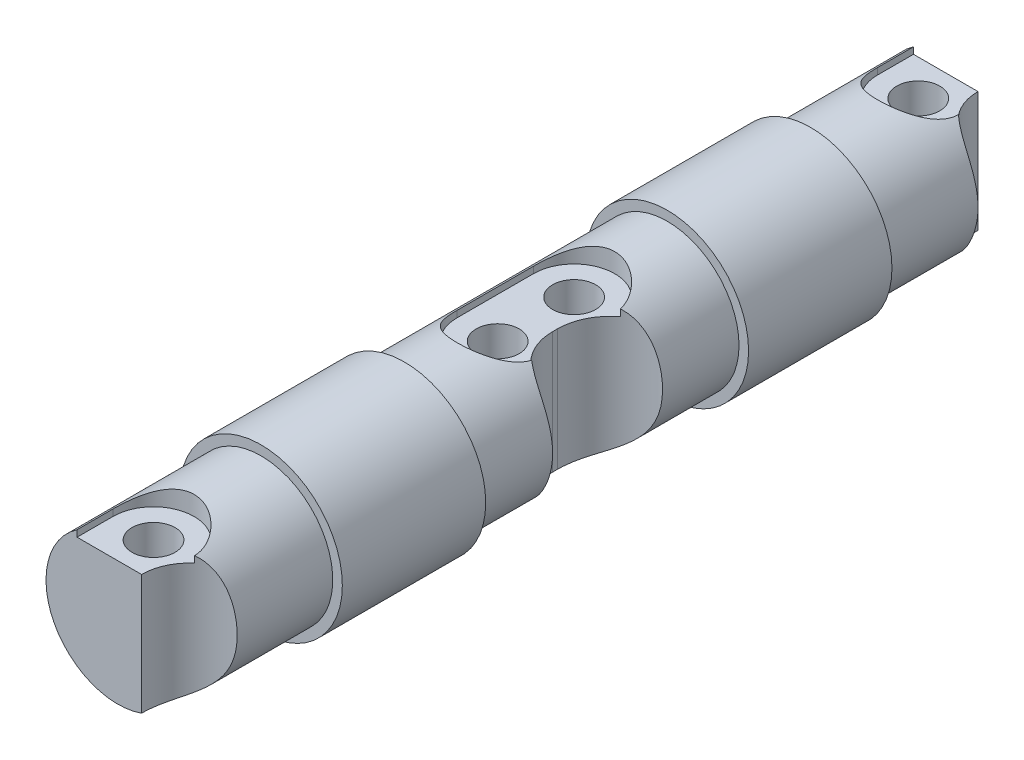
from build123d import *

# Parameters (mm, degrees)
CROQUIS1_R                 = 15
SALIENTE_EXTRUIR1_DEPTH    = 175
CROQUIS2_R                 = 4.5
CORTAR_EXTRUIR1_DEPTH      = 177.281025638
CORTAR_EXTRUIR2_START      = 15
CORTAR_EXTRUIR2_DEPTH      = 4
CROQUIS4_R                 = 10
CORTAR_EXTRUIR3_DEPTH      = 177.281025756
CORTAR_EXTRUIR4_DEPTH      = 177.281025756
CORTAR_EXTRUIR4_DEPTH_BACK = 177.281025756
CROQUIS9_R                 = 4.5
CORTAR_EXTRUIR5_START      = 15
CORTAR_EXTRUIR5_DEPTH      = 4
CORTAR_EXTRUIR6_DEPTH      = 177.281025756
CORTAR_EXTRUIR6_DEPTH_BACK = 177.281025756
SALIENTE_EXTRUIR2_START    = 30
CROQUIS16_R                = 17
CROQUIS16_R_2              = 15
SALIENTE_EXTRUIR2_DEPTH    = 30


with BuildPart() as part:
    # Croquis1 → Saliente-Extruir1 (new body)
    with BuildSketch(Plane.XY):
        Circle(CROQUIS1_R)
    extrude(amount=SALIENTE_EXTRUIR1_DEPTH)

    # Croquis2 → Cortar-Extruir1 (cut, symmetric)
    with BuildSketch(Plane(origin=(0, 0, 0), x_dir=(1, 0, 0), z_dir=(0, 1, 0))):
        with Locations((0, -7.5)):
            Circle(CROQUIS2_R)
    cortar_extruir1 = extrude(amount=CORTAR_EXTRUIR1_DEPTH, both=True, mode=Mode.SUBTRACT)

    # Croquis3 → Cortar-Extruir2 (cut)
    with BuildSketch(Plane(origin=(0, 0, 0), x_dir=(1, 0, 0), z_dir=(0, 1, 0)).offset(CORTAR_EXTRUIR2_START)):
        with BuildLine():
            Line((-8.5, -7.5), (-8.5, 0))
            Line((-8.5, 0), (8.5, 0))
            Line((8.5, 0), (8.5, -7.5))
            ThreePointArc((8.5, -7.5), (0, -16), (-8.5, -7.5))
        make_face()
    cortar_extruir2 = extrude(amount=-CORTAR_EXTRUIR2_DEPTH, mode=Mode.SUBTRACT)

    # Croquis4 → Cortar-Extruir3 (cut, symmetric)
    with BuildSketch(Plane(origin=(0, 0, 0), x_dir=(1, 0, 0), z_dir=(0, 1, 0))):
        with Locations((15, 0)):
            Circle(CROQUIS4_R)
    cortar_extruir3 = extrude(amount=CORTAR_EXTRUIR3_DEPTH, both=True, mode=Mode.SUBTRACT)

    # Simetría1: Cortar-Extruir1, Cortar-Extruir2, Cortar-Extruir3 across plane
    add(cortar_extruir1.mirror(Plane.XY.offset(87.5)), mode=Mode.SUBTRACT)
    add(cortar_extruir2.mirror(Plane.XY.offset(87.5)), mode=Mode.SUBTRACT)
    add(cortar_extruir3.mirror(Plane.XY.offset(87.5)), mode=Mode.SUBTRACT)

    # Croquis9 → Cortar-Extruir4 (cut, two sides: drawn at the far end of the back side and taken through both)
    with BuildSketch(Plane(origin=(0, 0, 0), x_dir=(1, 0, 0), z_dir=(0, 1, 0)).offset(-CORTAR_EXTRUIR4_DEPTH_BACK)):
        with Locations((0, -79.5)):
            Circle(CROQUIS9_R)
        with Locations((0, -95.5)):
            Circle(CROQUIS9_R)
    extrude(amount=CORTAR_EXTRUIR4_DEPTH + CORTAR_EXTRUIR4_DEPTH_BACK, mode=Mode.SUBTRACT)

    # Croquis10 → Cortar-Extruir5 (cut)
    with BuildSketch(Plane(origin=(0, 0, 0), x_dir=(1, 0, 0), z_dir=(0, 1, 0)).offset(CORTAR_EXTRUIR5_START)):
        with BuildLine():
            Line((8.5, -79.5), (8.5, -95.5))
            ThreePointArc((8.5, -95.5), (0, -104), (-8.5, -95.5))
            Line((-8.5, -95.5), (-8.5, -79.5))
            ThreePointArc((-8.5, -79.5), (0, -71), (8.5, -79.5))
        make_face()
    extrude(amount=-CORTAR_EXTRUIR5_DEPTH, mode=Mode.SUBTRACT)

    # Croquis15 → Cortar-Extruir6 (cut, two sides: drawn at the far end of the back side and taken through both)
    with BuildSketch(Plane(origin=(0, 0, 0), x_dir=(1, 0, 0), z_dir=(0, 1, 0)).offset(-CORTAR_EXTRUIR6_DEPTH_BACK)):
        with BuildLine():
            Line((4, -88), (4, -87))
            ThreePointArc((4, -87), (7.221825407, -79.221825407), (15, -76))
            Line((15, -76), (15, -99))
            ThreePointArc((15, -99), (7.221825407, -95.778174593), (4, -88))
        make_face()
    extrude(amount=CORTAR_EXTRUIR6_DEPTH + CORTAR_EXTRUIR6_DEPTH_BACK, mode=Mode.SUBTRACT)

    # Croquis16 → Saliente-Extruir2 (add)
    with BuildSketch(Plane.XY.offset(SALIENTE_EXTRUIR2_START)):
        Circle(CROQUIS16_R)
        Circle(CROQUIS16_R_2, mode=Mode.SUBTRACT)
    saliente_extruir2 = extrude(amount=SALIENTE_EXTRUIR2_DEPTH)

    # Simetría2: Saliente-Extruir2 across plane
    add(saliente_extruir2.mirror(Plane.XY.offset(87.5)))


solid = part.part
